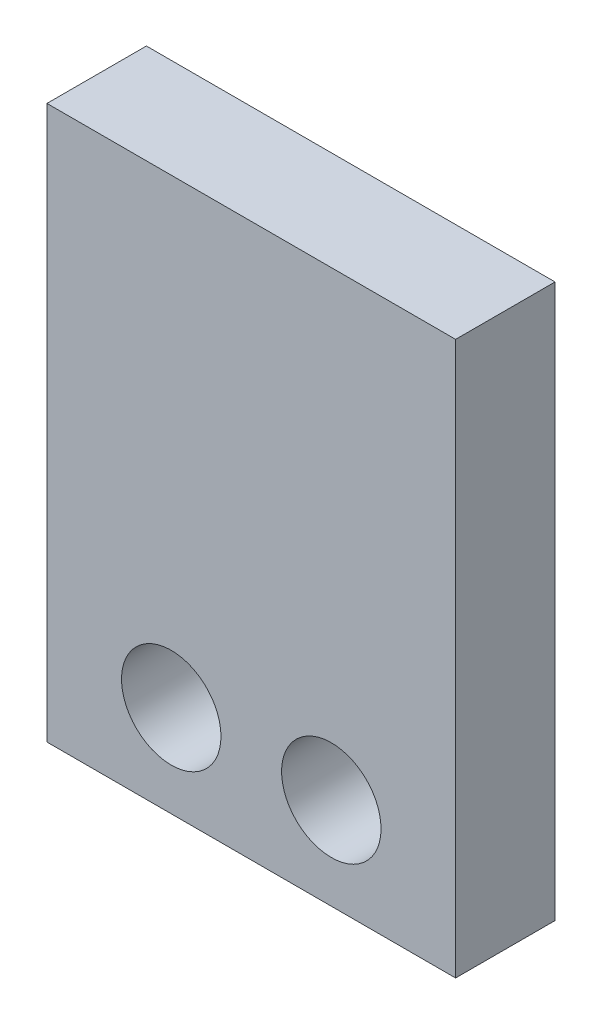
from build123d import *

# Parameters (mm, degrees)
SKETCH1_W           = 82.19569128
SKETCH1_H           = 111.247616646
SKETCH1_R           = 10
BOSS_EXTRUDE2_DEPTH = 20


with BuildPart() as part:
    # Sketch1 → Boss-Extrude2 (new body)
    with BuildSketch(Plane.XY):
        with Locations((-544.141983558, 37.138625296)):
            Rectangle(SKETCH1_W, SKETCH1_H)
        with Locations((-528.044137918, 0)):
            Circle(SKETCH1_R, mode=Mode.SUBTRACT)
        with Locations((-560.239829198, 0)):
            Circle(SKETCH1_R, mode=Mode.SUBTRACT)
    extrude(amount=BOSS_EXTRUDE2_DEPTH)


solid = part.part
